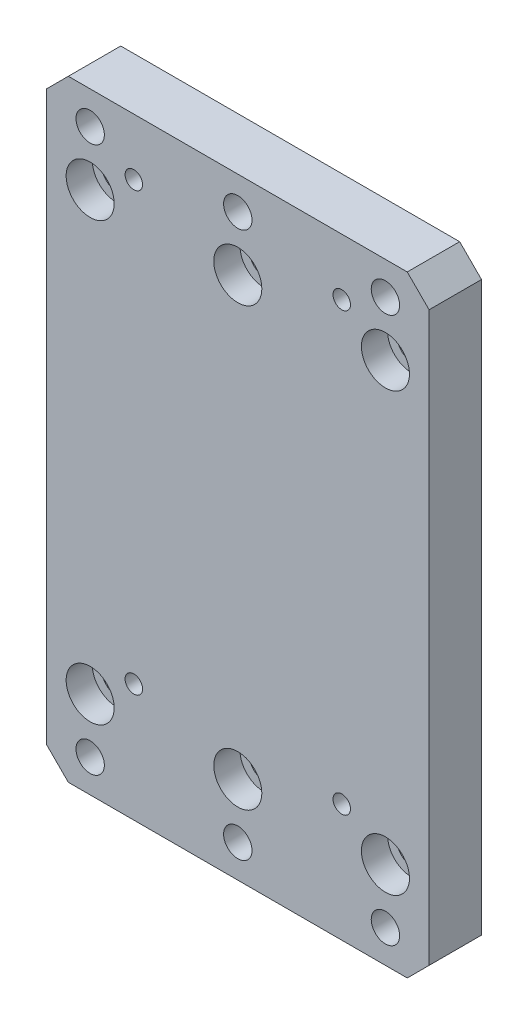
from build123d import *

# Parameters (mm, degrees)
SKETCH_1_W                   = 87.6
SKETCH_1_H                   = 140
EXTRUDE_1_DEPTH              = 12
CHAMFER_1_SIZE               = 5
HOLE_WIZARD_M6_1_D           = 6.6
HOLE_WIZARD_M6_1_CBORE_D     = 11
HOLE_WIZARD_M6_1_CBORE_DEPTH = 6
SKETCH_4_R                   = 2
CUT_EXTRUDE_1_DEPTH          = 84.441236808
SKETCH_5_R                   = 3.25
CUT_EXTRUDE_2_DEPTH          = 84.441236808


with BuildPart() as part:
    # 草图1 → 凸台-拉伸1 (new body)
    with BuildSketch(Plane.XY):
        Rectangle(SKETCH_1_W, SKETCH_1_H)
    extrude(amount=EXTRUDE_1_DEPTH)

    # 倒角1
    chamfer_1_edges = [part.edges().sort_by_distance(p)[0] for p in [
        (43.8, -70, 6),
        (-43.8, -70, 6),
        (-43.8, 70, 6),
        (43.8, 70, 6),
    ]]
    chamfer(chamfer_1_edges, length=CHAMFER_1_SIZE)

    # M6 六角凹头螺钉的柱形沉头孔1 (through all)
    with Locations(Plane.XY.offset(12)):
        with Locations((33.8, 50), (0, 50), (-33.8, 50), (-33.8, -50), (0, -50), (33.8, -50)):
            CounterBoreHole(HOLE_WIZARD_M6_1_D / 2, HOLE_WIZARD_M6_1_CBORE_D / 2, HOLE_WIZARD_M6_1_CBORE_DEPTH)

    # 草图4 → 切除-拉伸1 (cut, through all)
    with BuildSketch(Plane.XY.offset(12)):
        with Locations((-23.8, 57)):
            Circle(SKETCH_4_R)
        with Locations((23.8, 57)):
            Circle(SKETCH_4_R)
        with Locations((23.8, -43)):
            Circle(SKETCH_4_R)
        with Locations((-23.8, -43)):
            Circle(SKETCH_4_R)
    extrude(amount=-CUT_EXTRUDE_1_DEPTH, mode=Mode.SUBTRACT)

    # 草图5 → 切除-拉伸2 (cut, through all)
    with BuildSketch(Plane(origin=(0, 0, 0), x_dir=(-1, 0, 0), z_dir=(0, 0, -1))):
        with Locations((33.8, 62.5)):
            Circle(SKETCH_5_R)
        with Locations((0, 62.5)):
            Circle(SKETCH_5_R)
        with Locations((-33.8, 62.5)):
            Circle(SKETCH_5_R)
        with Locations((33.8, -62.5)):
            Circle(SKETCH_5_R)
        with Locations((0, -62.5)):
            Circle(SKETCH_5_R)
        with Locations((-33.8, -62.5)):
            Circle(SKETCH_5_R)
    extrude(amount=-CUT_EXTRUDE_2_DEPTH, mode=Mode.SUBTRACT)


solid = part.part
